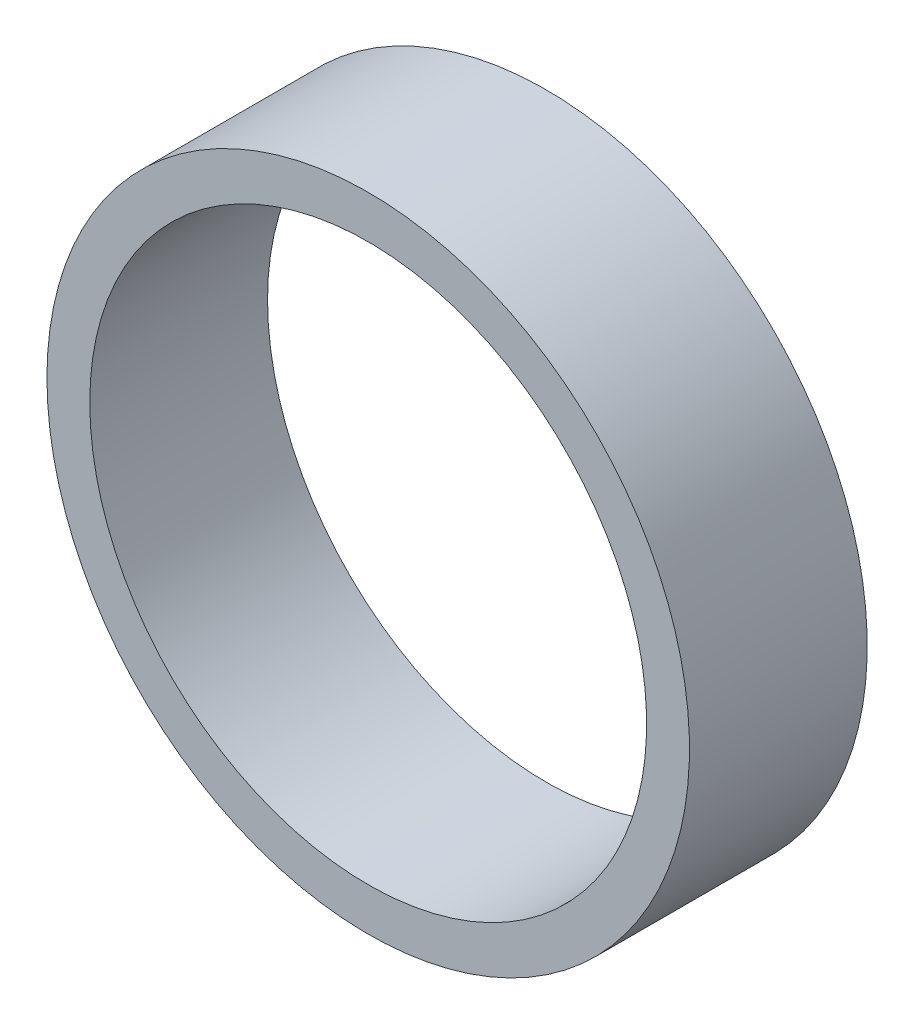
from build123d import *

# Parameters (mm, degrees)
SKETCH1_R           = 7.5
SKETCH1_R_2         = 6.5
BOSS_EXTRUDE1_DEPTH = 4.15


with BuildPart() as part:
    # Sketch1 → Boss-Extrude1 (new body)
    with BuildSketch(Plane.XY):
        with Locations(Location((0, 0, 0), (0, 0, 180))):
            Circle(SKETCH1_R)
        with Locations(Location((0, 0, 0), (0, 0, 180))):
            Circle(SKETCH1_R_2, mode=Mode.SUBTRACT)
    extrude(amount=BOSS_EXTRUDE1_DEPTH)


solid = part.part
